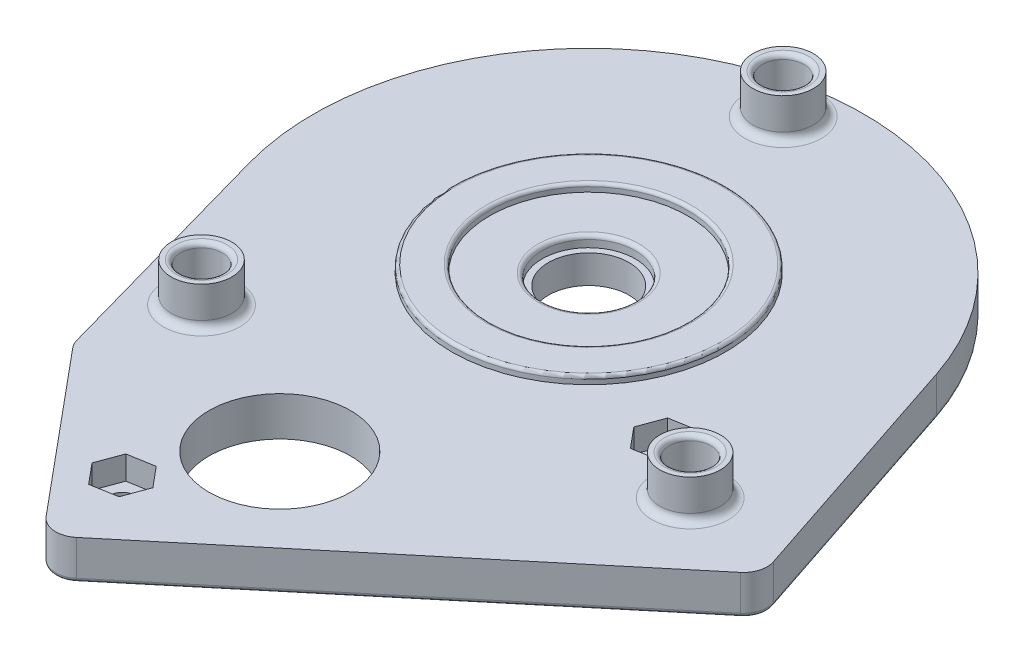
from build123d import *

# Parameters (mm, degrees)
SKETCH1_R           = 1.6
SKETCH1_R_2         = 9
SKETCH1_R_3         = 5.125
BOSS_EXTRUDE1_DEPTH = 5
BOSS_EXTRUDE2_START = 5
SKETCH1_3_R         = 12.6
BOSS_EXTRUDE2_DEPTH = 1
SKETCH1_4_R         = 3
CUT_EXTRUDE1_DEPTH  = 3
FILLET1_R           = 3
CUT_EXTRUDE2_START  = 3.6
SKETCH1_6_R         = 5.925
SKETCH1_6_R_2       = 5.125
CUT_EXTRUDE2_DEPTH  = 1.4
FILLET3_R           = 0.5
BOSS_EXTRUDE3_START = 3
SKETCH1_7_R         = 1.6
BOSS_EXTRUDE3_DEPTH = 0.2
SKETCH2_R           = 1.6
CUT_EXTRUDE3_DEPTH  = 77.388097719
CUT_EXTRUDE4_START  = -5
CUT_EXTRUDE4_DEPTH  = 3
FILLET4_R           = 0.5
FILLET5_R           = 0.4
SKETCH3_R           = 3.85
SKETCH3_R_2         = 2.65
BOSS_EXTRUDE4_DEPTH = 5
FILLET6_R           = 0.6
FILLET7_R           = 1


with BuildPart() as part:
    # Sketch1 → Boss-Extrude1 (new body)
    with BuildSketch(Plane(origin=(0, 0, 0), x_dir=(1, 0, 0), z_dir=(0, 1, 0))):
        with BuildLine():
            Line((-24.967532009, -40.548713224), (-5.768144267, -63.600470431))
            Line((-5.768144267, -63.600470431), (44.177329682, -22.001796991))
            Line((44.177329682, -22.001796991), (33.218915104, 11.022870738))
            ThreePointArc((33.218915104, 11.022870738), (-10.245273875, 33.466914456), (-33.696714348, -9.462105586))
            Line((-33.696714348, -9.462105586), (-24.967532009, -40.548713224))
        make_face()
        with Locations(Location((31.1958571, -18.297488882, 0), (0, 0, 270))):
            Circle(SKETCH1_R, mode=Mode.SUBTRACT)
        with Locations(Location((0, -39.275, 0), (0, 0, 270))):
            Circle(SKETCH1_R_2, mode=Mode.SUBTRACT)
        with Locations(Location((-21.106183258, -28.12265474, 0), (0, 0, 270))):
            Circle(SKETCH1_R, mode=Mode.SUBTRACT)
        with Locations(Location((0, 0, 0), (0, 0, 270))):
            Circle(SKETCH1_R_3, mode=Mode.SUBTRACT)
        with Locations(Location((-4.875970821, 29.601096408, 0), (0, 0, 270))):
            Circle(SKETCH1_R, mode=Mode.SUBTRACT)
    extrude(amount=BOSS_EXTRUDE1_DEPTH)

    # Sketch1<3> → Boss-Extrude2 (add)
    # profile 1 of 2: a face of its own
    with BuildSketch(Plane(origin=(0, 0, 0), x_dir=(1, 0, 0), z_dir=(0, 1, 0)).offset(BOSS_EXTRUDE2_START)):
        with BuildLine():
            ThreePointArc((17.4, 0), (-13.379903661, 11.123766359), (3.177220917, -17.107462326))
            Line((3.177220917, -17.107462326), (16.250757479, -6.218752397))
            ThreePointArc((16.250757479, -6.218752397), (17.110277323, -3.162026239), (17.4, 0))
        make_face()
        with Locations(Location((0, 0, 0), (0, 0, 270))):
            Circle(SKETCH1_3_R, mode=Mode.SUBTRACT)
    # profile 2 of 2: a face of its own
    with BuildSketch(Plane(origin=(0, 0, 0), x_dir=(1, 0, 0), z_dir=(0, 1, 0)).offset(BOSS_EXTRUDE2_START)):
        with BuildLine():
            Line((16.250757479, -6.218752397), (3.177220917, -17.107462326))
            ThreePointArc((3.177220917, -17.107462326), (11.13564489, -13.37001918), (16.250757479, -6.218752397))
        make_face()
    extrude(amount=BOSS_EXTRUDE2_DEPTH)

    # Sketch1<4> → Cut-Extrude1 (cut)
    with BuildSketch(Plane(origin=(0, 0, 0), x_dir=(1, 0, 0), z_dir=(0, 1, 0))):
        with Locations(Location((-21.106183258, -28.12265474, 0), (0, 0, 270))):
            Circle(SKETCH1_4_R)
        with Locations(Location((31.1958571, -18.297488882, 0), (0, 0, 270))):
            Circle(SKETCH1_4_R)
        with Locations(Location((-4.875970821, 29.601096408, 0), (0, 0, 270))):
            Circle(SKETCH1_4_R)
    extrude(amount=CUT_EXTRUDE1_DEPTH, mode=Mode.SUBTRACT)

    # Fillet1
    fillet1_edges = [part.edges().sort_by_distance(p)[0] for p in [
        (44.177329682, 2.5, 22.001796991),
        (-5.768144267, 2.5, 63.600470431),
        (-24.967532009, 2.5, 40.548713224),
    ]]
    fillet(fillet1_edges, radius=FILLET1_R)

    # Sketch1<6> → Cut-Extrude2 (cut)
    with BuildSketch(Plane(origin=(0, 0, 0), x_dir=(1, 0, 0), z_dir=(0, 1, 0)).offset(CUT_EXTRUDE2_START)):
        with Locations(Location((0, 0, 0), (0, 0, 270))):
            Circle(SKETCH1_6_R)
        with Locations(Location((0, 0, 0), (0, 0, 270))):
            Circle(SKETCH1_6_R_2, mode=Mode.SUBTRACT)
    extrude(amount=CUT_EXTRUDE2_DEPTH, mode=Mode.SUBTRACT)

    # Fillet3
    fillet3_edges = [part.edges().sort_by_distance(p)[0] for p in [
        (0, 5, -5.925),
    ]]
    fillet(fillet3_edges, radius=FILLET3_R)

    # Sketch1<7> → Boss-Extrude3 (add)
    with BuildSketch(Plane(origin=(0, 0, 0), x_dir=(1, 0, 0), z_dir=(0, 1, 0)).offset(BOSS_EXTRUDE3_START)):
        with Locations(Location((31.1958571, -18.297488882, 0), (0, 0, 270))):
            Circle(SKETCH1_7_R)
        with Locations(Location((-21.106183258, -28.12265474, 0), (0, 0, 270))):
            Circle(SKETCH1_7_R)
        with Locations(Location((-4.875970821, 29.601096408, 0), (0, 0, 270))):
            Circle(SKETCH1_7_R)
    extrude(amount=BOSS_EXTRUDE3_DEPTH)

    # Sketch2 → Cut-Extrude3 (cut, through all)
    with BuildSketch(Plane.XZ):
        with Locations(Location((-7.365490763, 51.916678916, 0), (0, 0, 270))):
            Circle(SKETCH2_R)
        with Locations(Location((23.117524854, 13.51373946, 0), (0, 0, 270))):
            Circle(SKETCH2_R)
    extrude(amount=-CUT_EXTRUDE3_DEPTH, mode=Mode.SUBTRACT)

    # Sketch2<3> → Cut-Extrude4 (cut)
    with BuildSketch(Plane.XZ.offset(CUT_EXTRUDE4_START)):
        Polygon((19.817660395, 14.08314958), (20.974468996, 10.940678069), (24.274333455, 10.37126795), (26.417389314, 12.944329341), (25.260580713, 16.086800851), (21.960716254, 16.656210971), align=None)
        Polygon((-10.665355222, 52.486089036), (-9.508546621, 49.343617525), (-6.208682162, 48.774207406), (-4.065626304, 51.347268797), (-5.222434905, 54.489740307), (-8.522299364, 55.059150427), align=None)
    extrude(amount=CUT_EXTRUDE4_DEPTH, mode=Mode.SUBTRACT)

    # Fillet4
    fillet4_edges = [part.edges().sort_by_distance(p)[0] for p in [
        (-10.245273875, 0, -33.466914456),
        (38.376067251, 0, 4.518906303),
        (-29.418708961, 0, 24.697057701),
        (19.571427023, 0, 42.495604107),
        (-16.122836267, 0, 51.16810284),
        (-24.907679574, 0, 40.517239907),
        (-5.655310978, 0, 62.362963047),
        (43.570730463, 0, 21.828701805),
    ]]
    fillet(fillet4_edges, radius=FILLET4_R)

    # Fillet5
    fillet5_edges = [part.edges().sort_by_distance(p)[0] for p in [
        (-3.177220917, 6, -17.107462326),
        (0, 6, -12.6),
    ]]
    fillet(fillet5_edges, radius=FILLET5_R)

    # Sketch3 → Boss-Extrude4 (add)
    # profile 1 of 3: a face of its own
    with BuildSketch(Plane(origin=(0, 5, 0), x_dir=(1, 0, 0), z_dir=(0, 1, 0))):
        with Locations(Location((31.1958571, -18.297488882, 0), (0, 0, 270))):
            Circle(SKETCH3_R)
        with Locations(Location((31.1958571, -18.297488882, 0), (0, 0, 270))):
            Circle(SKETCH3_R_2, mode=Mode.SUBTRACT)
    # profile 2 of 3: a face of its own
    with BuildSketch(Plane(origin=(0, 5, 0), x_dir=(1, 0, 0), z_dir=(0, 1, 0))):
        with Locations(Location((-21.106183258, -28.12265474, 0), (0, 0, 270))):
            Circle(SKETCH3_R)
        with Locations(Location((-21.106183258, -28.12265474, 0), (0, 0, 270))):
            Circle(SKETCH3_R_2, mode=Mode.SUBTRACT)
    # profile 3 of 3: a face of its own
    with BuildSketch(Plane(origin=(0, 5, 0), x_dir=(1, 0, 0), z_dir=(0, 1, 0))):
        with Locations(Location((-4.875970821, 29.601096408, 0), (0, 0, 270))):
            Circle(SKETCH3_R)
        with Locations(Location((-4.875970821, 29.601096408, 0), (0, 0, 270))):
            Circle(SKETCH3_R_2, mode=Mode.SUBTRACT)
    extrude(amount=BOSS_EXTRUDE4_DEPTH)

    # Fillet6
    fillet6_edges = [part.edges().sort_by_distance(p)[0] for p in [
        (31.1958571, 10, 15.647488882),
        (-21.106183258, 10, 25.47265474),
        (-4.875970821, 10, -32.251096408),
    ]]
    fillet(fillet6_edges, radius=FILLET6_R)

    # Fillet7
    fillet7_edges = [part.edges().sort_by_distance(p)[0] for p in [
        (31.1958571, 5, 14.447488882),
        (-21.106183258, 5, 24.27265474),
        (-4.875970821, 5, -33.451096408),
    ]]
    fillet(fillet7_edges, radius=FILLET7_R)


solid = part.part
